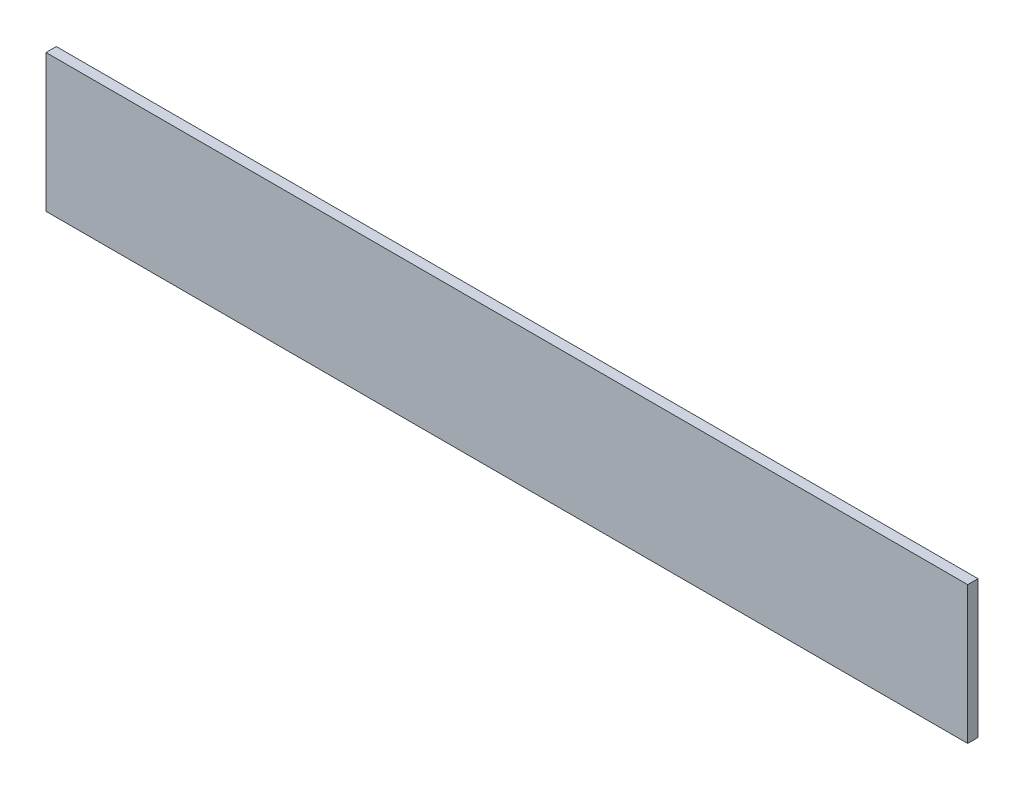
from build123d import *

# Parameters (mm, degrees)
SKETCH1_W           = 425.45
SKETCH1_H           = 63.5
BOSS_EXTRUDE1_DEPTH = 4.7625


with BuildPart() as part:
    # Sketch1 → Boss-Extrude1 (new body)
    with BuildSketch(Plane.XY):
        with Locations((212.725, 31.75)):
            Rectangle(SKETCH1_W, SKETCH1_H)
    extrude(amount=BOSS_EXTRUDE1_DEPTH)


solid = part.part
